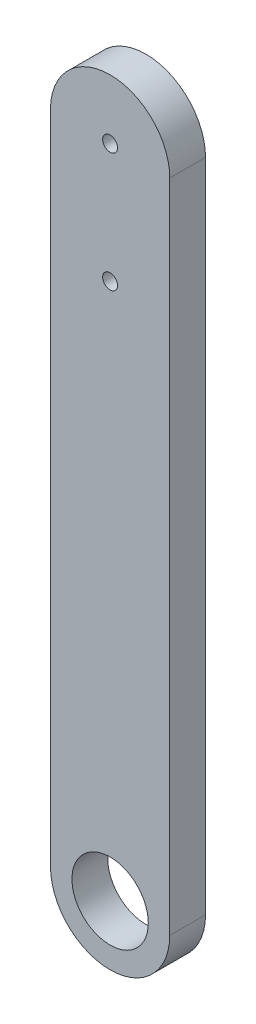
from build123d import *

# Parameters (mm, degrees)
ESQUISSE1_R        = 1.25
ESQUISSE1_R_2      = 6.4
BOSS_EXTRU_1_DEPTH = 6


with BuildPart() as part:
    # Esquisse1 → Boss.-Extru.1 (new body)
    with BuildSketch(Plane.XY):
        with BuildLine():
            Line((-79.14107268, -13.7), (-79.14107268, -123.7))
            ThreePointArc((-79.14107268, -123.7), (-69.14107268, -133.7), (-59.14107268, -123.7))
            Line((-59.14107268, -123.7), (-59.14107268, -13.7))
            ThreePointArc((-59.14107268, -13.7), (-69.14107268, -3.7), (-79.14107268, -13.7))
        make_face()
        with Locations((-69.14107268, -13.7)):
            Circle(ESQUISSE1_R, mode=Mode.SUBTRACT)
        with Locations((-69.14107268, -33.7)):
            Circle(ESQUISSE1_R, mode=Mode.SUBTRACT)
        with Locations((-69.14107268, -123.7)):
            Circle(ESQUISSE1_R_2, mode=Mode.SUBTRACT)
    extrude(amount=BOSS_EXTRU_1_DEPTH)


solid = part.part
